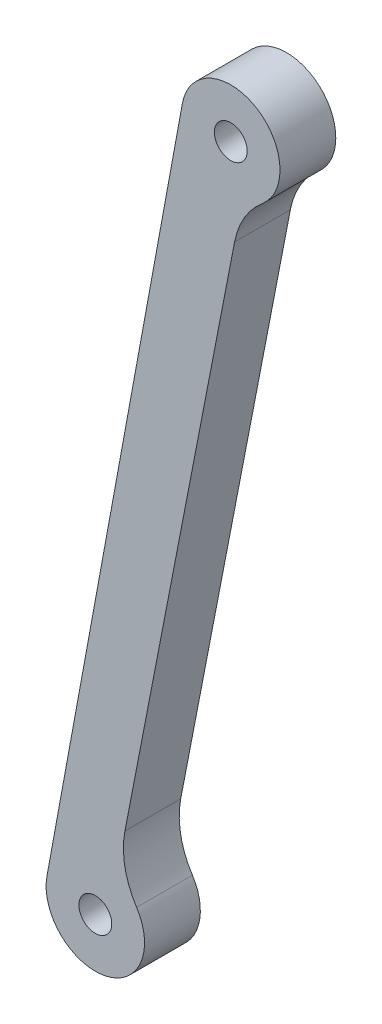
from build123d import *

# Parameters (mm, degrees)
SKETCH7_R           = 1
BOSS_EXTRUDE2_DEPTH = 3.4


with BuildPart() as part:
    # Sketch7 → Boss-Extrude2 (new body)
    with BuildSketch(Plane.XY):
        with BuildLine():
            Line((14.939494353, 43.671800322), (23.195274145, 88.592442488))
            ThreePointArc((23.195274145, 88.592442488), (27.655886689, 90.642426594), (28.073058509, 85.75106004))
            ThreePointArc((28.073058509, 85.75106004), (26.977195581, 84.457381822), (26.376654335, 82.871863263))
            Line((26.376654335, 82.871863263), (19.693168718, 48.435996906))
            ThreePointArc((19.693168718, 48.435996906), (19.693341996, 46.529807983), (20.406889033, 44.762208802))
            ThreePointArc((20.406889033, 44.762208802), (18.476836527, 40.187465572), (14.939494353, 43.671800322))
        make_face()
        with Locations((17.890076902, 43.129524909)):
            Circle(SKETCH7_R, mode=Mode.SUBTRACT)
        with Locations((26.145856694, 88.050167075)):
            Circle(SKETCH7_R, mode=Mode.SUBTRACT)
    extrude(amount=BOSS_EXTRUDE2_DEPTH)


solid = part.part
